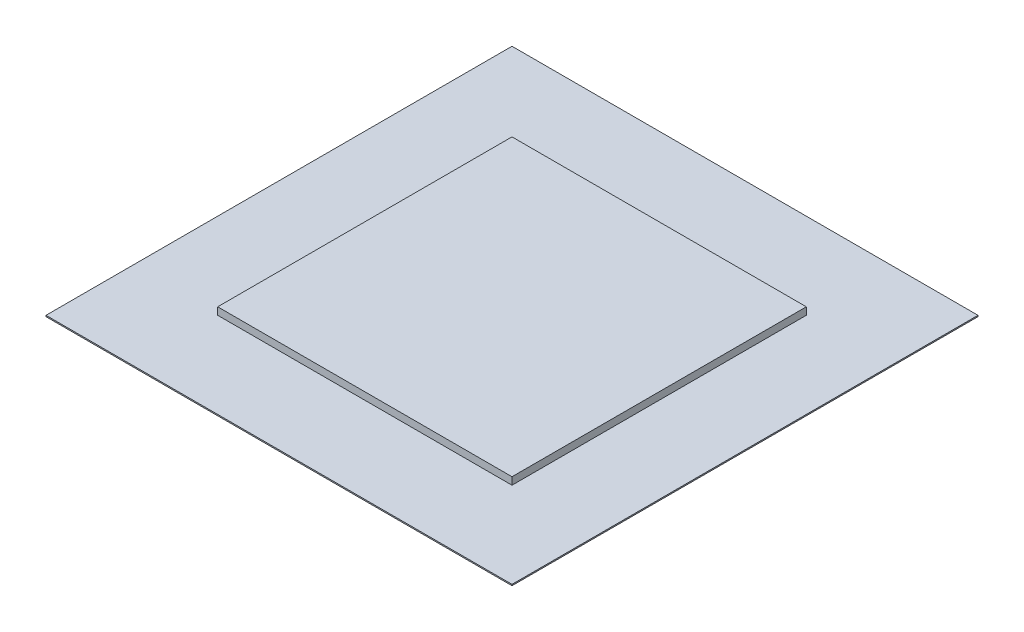
from build123d import *

# Parameters (mm, degrees)
SKETCH_1_W      = 2400
SKETCH_1_H      = 2400
EXTRUDE_1_DEPTH = 60
SKETCH_3_W      = 3800
SKETCH_3_H      = 3800
EXTRUDE_2_DEPTH = 10


with BuildPart() as part:
    # 草图1 → 凸台-拉伸1 (new body)
    with BuildSketch(Plane(origin=(0, 0, 0), x_dir=(1, 0, 0), z_dir=(0, 1, 0))):
        Rectangle(SKETCH_1_W, SKETCH_1_H)
    extrude(amount=EXTRUDE_1_DEPTH)

    # 草图3 → 凸台-拉伸2 (add)
    with BuildSketch(Plane.XZ):
        Rectangle(SKETCH_3_W, SKETCH_3_H)
    extrude(amount=EXTRUDE_2_DEPTH)


solid = part.part
